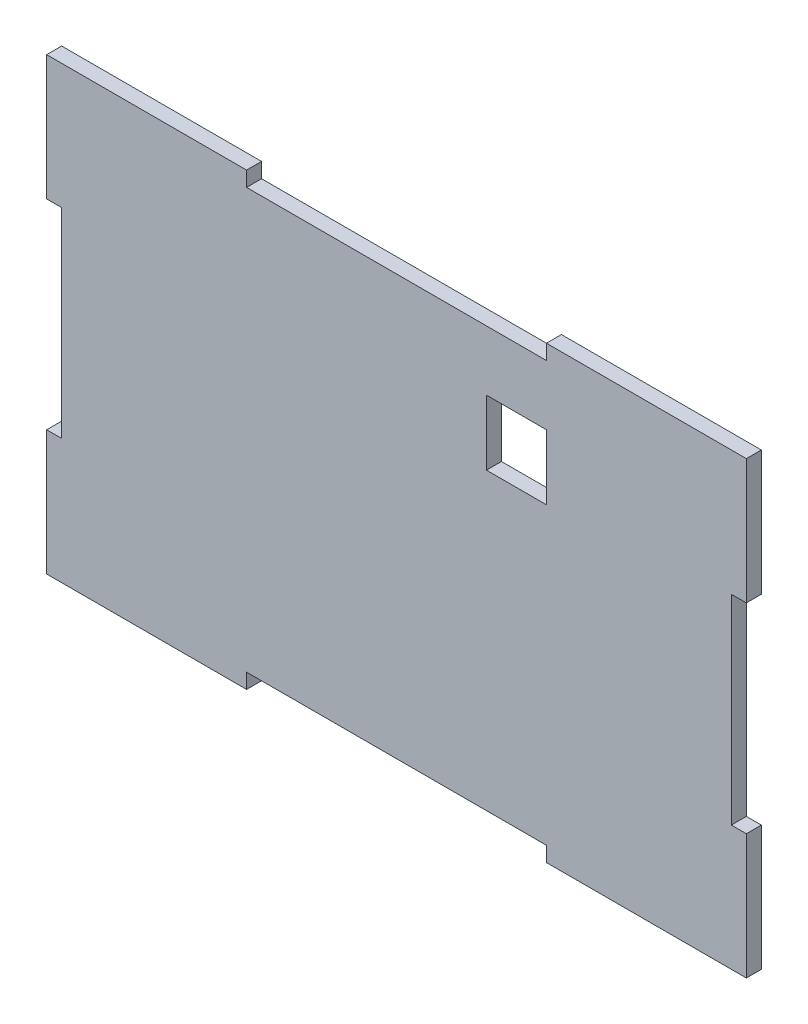
from build123d import *

# Parameters (mm, degrees)
EXTRUDE_1_DEPTH     = 3
SKETCH_2_W          = 12
SKETCH_2_H          = 13
CUT_EXTRUDE_1_DEPTH = 167.460205455


with BuildPart() as part:
    # Эскиз1 → Бобышка-Вытянуть1 (new body)
    with BuildSketch(Plane.XY):
        Polygon((0, 0), (40, 0), (40, 3), (100, 3), (100, 0), (140, 0), (140, 25), (137, 25), (137, 65), (140, 65), (140, 90), (100, 90), (100, 87), (40, 87), (40, 90), (0, 90), (0, 65), (3, 65), (3, 25), (0, 25), align=None)
    extrude(amount=EXTRUDE_1_DEPTH)

    # Эскиз2 → Вырез-Вытянуть1 (cut, through all)
    with BuildSketch(Plane.XY.offset(3)):
        with Locations((94, 68.5)):
            Rectangle(SKETCH_2_W, SKETCH_2_H)
    extrude(amount=-CUT_EXTRUDE_1_DEPTH, mode=Mode.SUBTRACT)


solid = part.part
